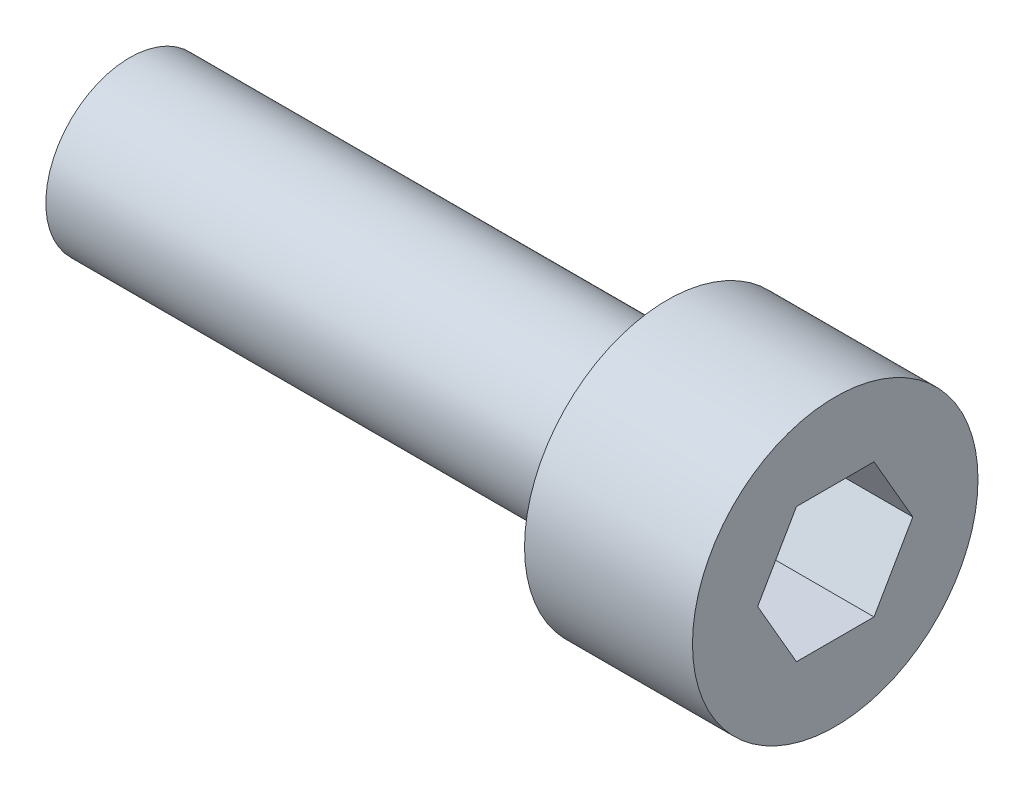
from build123d import *

# Parameters (mm, degrees)
ESQUISSE1_R             = 2.5
BOSS_EXTRU_1_DEPTH      = 16
ESQUISSE2_R             = 4.25
BOSS_EXTRU_2_DEPTH      = 5
ENL_V_MAT_EXTRU_1_DEPTH = 3.5


with BuildPart() as part:
    # Esquisse1 → Boss.-Extru.1 (new body)
    with BuildSketch(Plane(origin=(0, 0, 0), x_dir=(0, 0, -1), z_dir=(1, 0, 0))):
        Circle(ESQUISSE1_R)
    extrude(amount=BOSS_EXTRU_1_DEPTH)

    # Esquisse2 → Boss.-Extru.2 (add)
    with BuildSketch(Plane(origin=(16, 0, 0), x_dir=(0, 0, -1), z_dir=(1, 0, 0))):
        Circle(ESQUISSE2_R)
    extrude(amount=BOSS_EXTRU_2_DEPTH)

    # Esquisse3 → Enlèv. mat.-Extru.1 (cut)
    with BuildSketch(Plane(origin=(21, 0, 0), x_dir=(0, 0, -1), z_dir=(1, 0, 0))):
        Polygon((2.309401077, 0), (1.154700538, 2), (-1.154700538, 2), (-2.309401077, 0), (-1.154700538, -2), (1.154700538, -2), align=None)
    extrude(amount=-ENL_V_MAT_EXTRU_1_DEPTH, mode=Mode.SUBTRACT)


solid = part.part
